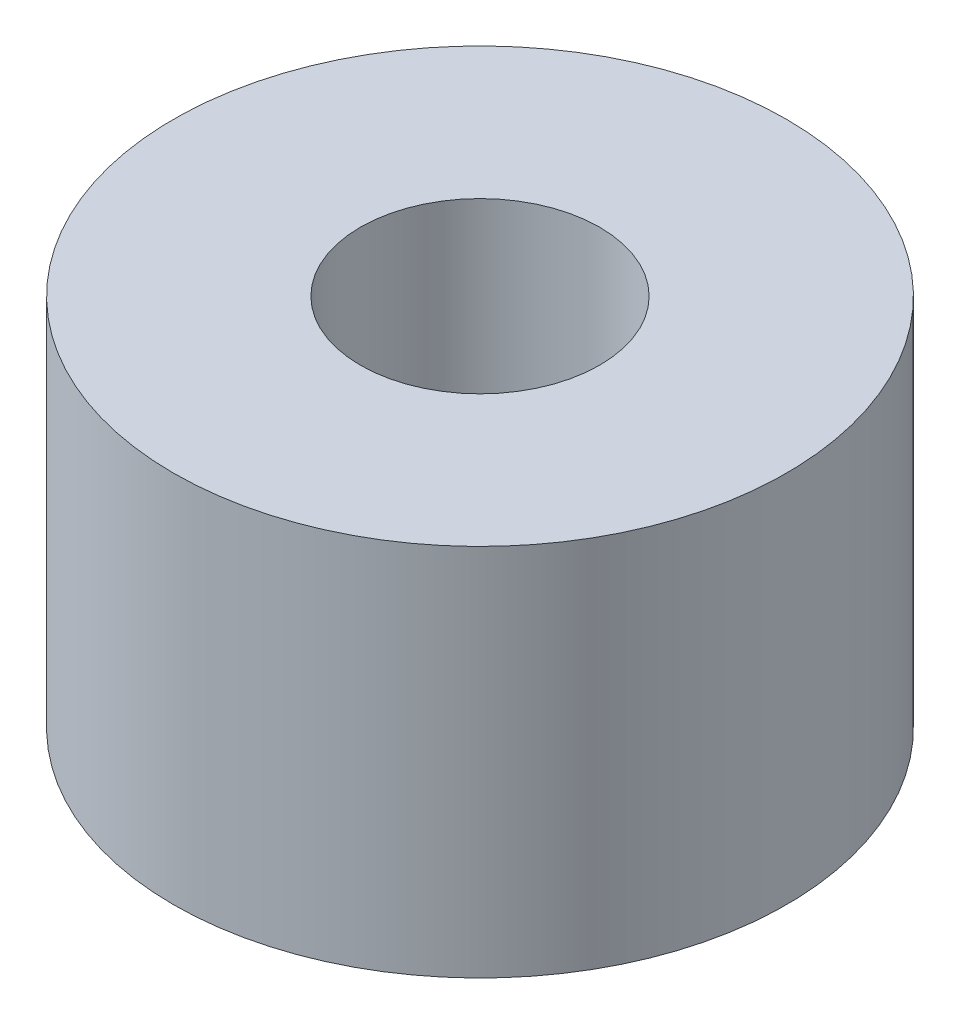
from build123d import *

# Parameters (mm, degrees)
SKETCH1_R           = 5.207
SKETCH1_R_2         = 2.032
BOSS_EXTRUDE1_DEPTH = 6.35


with BuildPart() as part:
    # Sketch1 → Boss-Extrude1 (new body)
    with BuildSketch(Plane(origin=(0, 0, 0), x_dir=(1, 0, 0), z_dir=(0, 1, 0))):
        Circle(SKETCH1_R)
        Circle(SKETCH1_R_2, mode=Mode.SUBTRACT)
    extrude(amount=BOSS_EXTRUDE1_DEPTH)


solid = part.part
